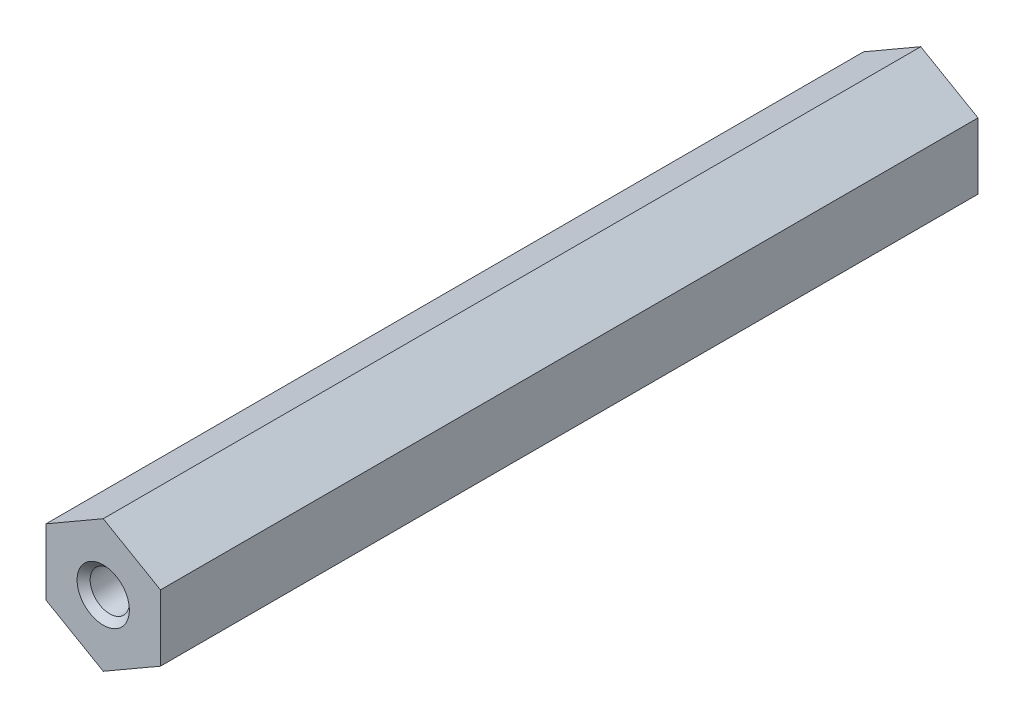
from build123d import *

# Parameters (mm, degrees)
EXTRUDE_1_DEPTH     = 50
SKETCH_2_R          = 1.2
CUT_EXTRUDE_1_DEPTH = 12
CHAMFER_1_SIZE      = 1.2
CHAMFER_1_SIZE2     = 0.692820323
SKETCH_3_R          = 2.1
CUT_EXTRUDE_2_DEPTH = 12
CHAMFER_2_SIZE      = 2.1
CHAMFER_2_SIZE2     = 1.212435565
CHAMFER_3_SIZE      = 0.4


with BuildPart() as part:
    # Эскиз1 → Вытянуть1 (new body)
    with BuildSketch(Plane.XY):
        Polygon((0, 4.041451884), (-3.5, 2.020725942), (-3.5, -2.020725942), (0, -4.041451884), (3.5, -2.020725942), (3.5, 2.020725942), align=None)
    extrude(amount=EXTRUDE_1_DEPTH)

    # Эскиз2 → Вырез-Вытянуть1 (cut)
    with BuildSketch(Plane.XY.offset(50)):
        Circle(SKETCH_2_R)
    extrude(amount=-CUT_EXTRUDE_1_DEPTH, mode=Mode.SUBTRACT)

    # Фаска1
    chamfer_1_edges = [part.edges().sort_by_distance(p)[0] for p in [
        (-1.2, 0, 38),
    ]]
    chamfer_1_side = [part.faces().sort_by_distance(p)[0] for p in [
        (0, 0, 38),
    ]]
    chamfer(chamfer_1_edges, length=CHAMFER_1_SIZE, length2=CHAMFER_1_SIZE2, reference=chamfer_1_side[0])

    # Эскиз3 → Вырез-Вытянуть2 (cut)
    with BuildSketch(Plane(origin=(0, 0, 0), x_dir=(-1, 0, 0), z_dir=(0, 0, -1))):
        Circle(SKETCH_3_R)
    extrude(amount=-CUT_EXTRUDE_2_DEPTH, mode=Mode.SUBTRACT)

    # Фаска2
    chamfer_2_edges = [part.edges().sort_by_distance(p)[0] for p in [
        (2.1, 0, 12),
    ]]
    chamfer_2_side = [part.faces().sort_by_distance(p)[0] for p in [
        (0, 0, 12),
    ]]
    chamfer(chamfer_2_edges, length=CHAMFER_2_SIZE, length2=CHAMFER_2_SIZE2, reference=chamfer_2_side[0])

    # Фаска3
    chamfer_3_edges = [part.edges().sort_by_distance(p)[0] for p in [
        (-1.2, 0, 50),
        (2.1, 0, 0),
    ]]
    chamfer(chamfer_3_edges, length=CHAMFER_3_SIZE)


solid = part.part
